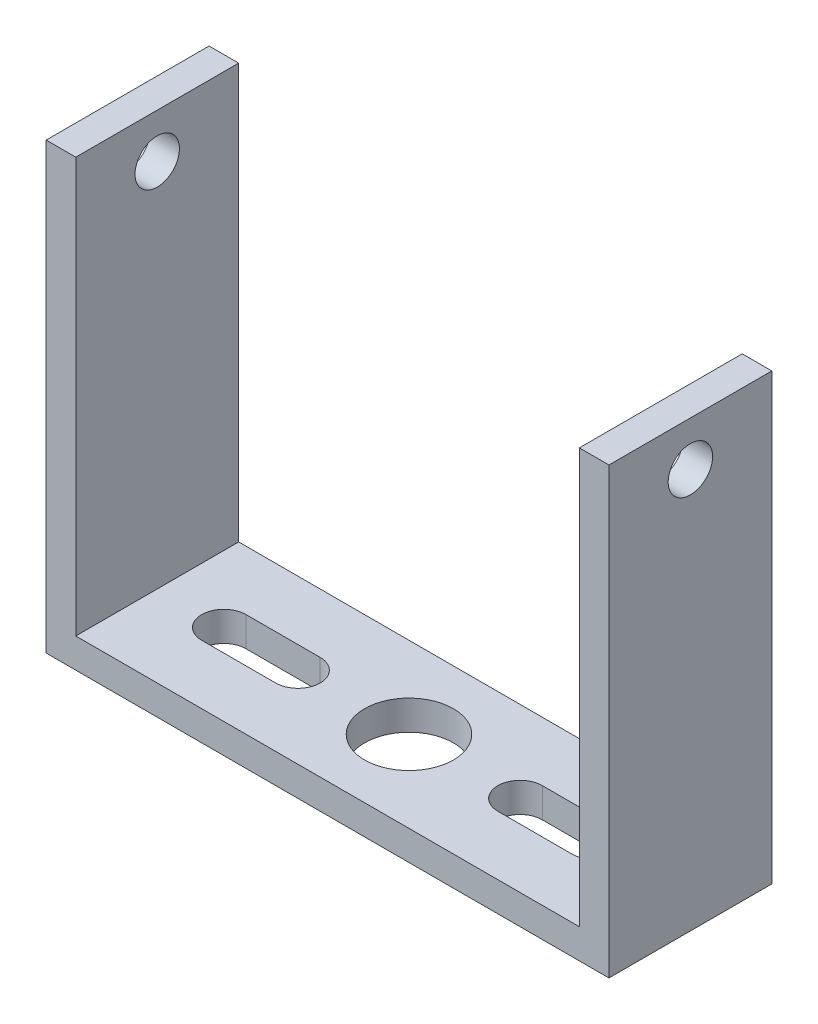
from build123d import *

# Parameters (mm, degrees)
EXTRUDE_1_DEPTH          = 11
CUT_EXTRUDE_1_DEPTH      = 50.648766349
CUT_EXTRUDE_1_DEPTH_BACK = 50.648766349
SKETCH_3_R               = 1.5
SKETCH_4_R               = 3
CUT_EXTRUDE_2_DEPTH      = 3


with BuildPart() as part:
    # 草图2 → 凸台-拉伸1 (new body)
    with BuildSketch(Plane.XY):
        Polygon((0, 30), (0, 0), (38, 0), (38, 30), (36, 30), (36, 2), (2, 2), (2, 30), align=None)
    extrude(amount=EXTRUDE_1_DEPTH)

    # 草图3 → 切除-拉伸1 (cut, two sides: drawn at the far end of the back side and taken through both)
    with BuildSketch(Plane.ZY.offset(-CUT_EXTRUDE_1_DEPTH_BACK)):
        with Locations((5.5, 27)):
            Circle(SKETCH_3_R)
    extrude(amount=CUT_EXTRUDE_1_DEPTH + CUT_EXTRUDE_1_DEPTH_BACK, mode=Mode.SUBTRACT)

    # 草图4 → 切除-拉伸2 (cut)
    with BuildSketch(Plane.XZ):
        with Locations(Location((19, 5.5, 0), (0, 0, 270))):
            Circle(SKETCH_4_R)
        with BuildLine():
            Line((26.5, 7), (31.5, 7))
            ThreePointArc((31.5, 7), (33, 5.5), (31.5, 4))
            Line((31.5, 4), (26.5, 4))
            ThreePointArc((26.5, 4), (25, 5.5), (26.5, 7))
        make_face()
        with BuildLine():
            Line((6.5, 7), (11.5, 7))
            ThreePointArc((11.5, 7), (13, 5.5), (11.5, 4))
            Line((11.5, 4), (6.5, 4))
            ThreePointArc((6.5, 4), (5, 5.5), (6.5, 7))
        make_face()
    extrude(amount=-CUT_EXTRUDE_2_DEPTH, mode=Mode.SUBTRACT)


solid = part.part
